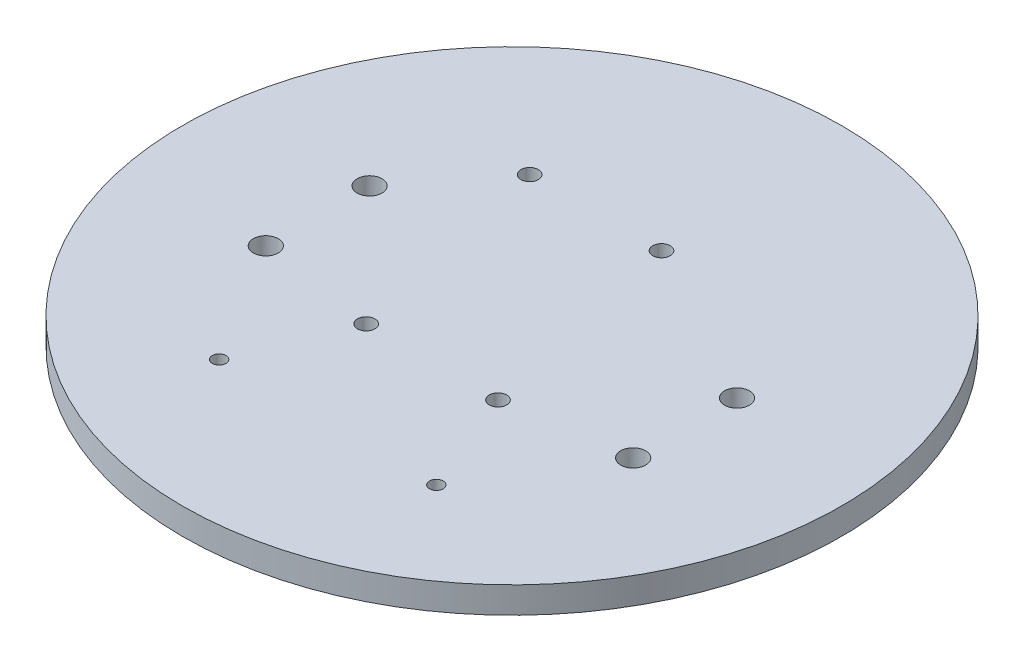
from build123d import *

# Parameters (mm, degrees)
SKETCH1_R                   = 79.375
BOSS_EXTRUDE1_DEPTH         = 3.175
TAP_DRILL_FOR_M5X0_8_TAP1_D = 4.2
TAP_DRILL_FOR_M7X1_0_TAP1_D = 6
TAP_DRILL_FOR_M4X0_7_TAP1_D = 3.3


with BuildPart() as part:
    # Sketch1 → Boss-Extrude1 (new, symmetric)
    with BuildSketch(Plane(origin=(0, 0, 0), x_dir=(1, 0, 0), z_dir=(0, 1, 0))):
        with Locations(Location((0, 0, 0), (0, 0, 270))):
            Circle(SKETCH1_R)
    extrude(amount=BOSS_EXTRUDE1_DEPTH, both=True)

    # Tap Drill for M5x0.8 Tap1 (through all)
    with Locations(Plane(origin=(0, 3.175, 0), x_dir=(1, 0, 0), z_dir=(0, 1, 0))):
        with Locations((-27.3188086, 31.571183672), (4.4311914, 31.571183672), (-15.875, -19.245910728), (15.875, -19.245910728)):
            Hole(TAP_DRILL_FOR_M5X0_8_TAP1_D / 2)

    # Tap Drill for M7x1.0 Tap1 (through all)
    with Locations(Plane(origin=(0, 3.175, 0), x_dir=(1, 0, 0), z_dir=(0, 1, 0))):
        with Locations((-44.245, 9.941583672), (-44.245, -15.058416328), (44.245, 9.941583672), (44.245, -15.058416328)):
            Hole(TAP_DRILL_FOR_M7X1_0_TAP1_D / 2)

    # Tap Drill for M4x0.7 Tap1 (through all)
    with Locations(Plane(origin=(0, 3.175, 0), x_dir=(1, 0, 0), z_dir=(0, 1, 0))):
        with Locations((-26.155, -44.384416328), (26.155, -44.384416328)):
            Hole(TAP_DRILL_FOR_M4X0_7_TAP1_D / 2)


solid = part.part
